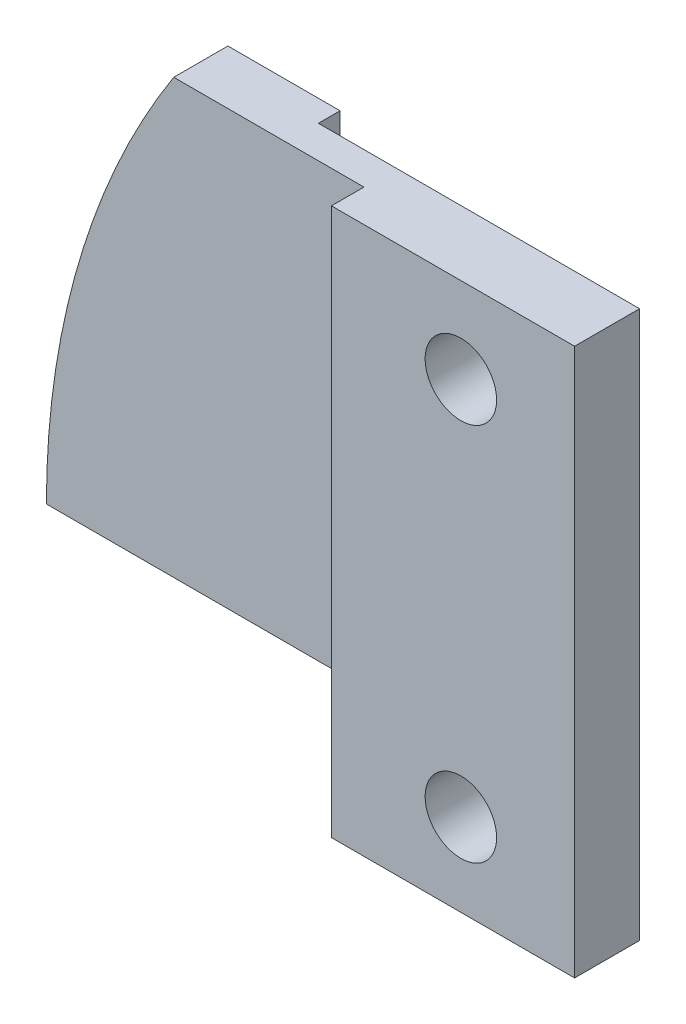
from build123d import *

# Parameters (mm, degrees)
SKETCH1_R           = 1.65
BOSS_EXTRUDE1_DEPTH = 2.5
SKETCH5_R           = 1.65
BOSS_EXTRUDE2_DEPTH = 1.5
CUT_EXTRUDE3_DEPTH  = 1


with BuildPart() as part:
    # Sketch1 → Boss-Extrude1 (new body)
    with BuildSketch(Plane.XY):
        with BuildLine():
            Line((-8.004553297, 23.25769142), (12, 23.25769142))
            Line((12, 23.25769142), (12, 0))
            Line((12, 0), (12, -2))
            Line((12, -2), (0.775731814, -2))
            Line((0.775731814, -2), (0.775731814, 0))
            Line((0.775731814, 0), (0.775731814, 3.25769142))
            Line((0.775731814, 3.25769142), (-13.882660061, 3.25769142))
            ThreePointArc((-13.882660061, 3.25769142), (-12.382699641, 13.680648524), (-8.004553297, 23.25769142))
        make_face()
        with Locations((6.74921921, 19.306101501)):
            Circle(SKETCH1_R, mode=Mode.SUBTRACT)
        with Locations((6.74921921, 1.806101501)):
            Circle(SKETCH1_R, mode=Mode.SUBTRACT)
    extrude(amount=BOSS_EXTRUDE1_DEPTH)

    # Sketch5 → Boss-Extrude2 (add)
    with BuildSketch(Plane.XY.offset(2.5)):
        Polygon((0.775731814, 3.25769142), (0.775731814, 23.25769142), (12, 23.25769142), (12, -2), (0.775731814, -2), align=None)
        with Locations((6.74921921, 19.306101501)):
            Circle(SKETCH5_R, mode=Mode.SUBTRACT)
        with Locations((6.74921921, 1.806101501)):
            Circle(SKETCH5_R, mode=Mode.SUBTRACT)
    extrude(amount=BOSS_EXTRUDE2_DEPTH)

    # Sketch6 → Cut-Extrude3 (cut)
    with BuildSketch(Plane(origin=(0, 0, 0), x_dir=(-1, 0, 0), z_dir=(0, 0, -1))):
        Polygon((-12, 23.25769142), (-12, -2), (-0.775731814, -2), (-0.775731814, 3.25769142), (2.826661011, 3.25769142), (2.826661011, 23.25769142), align=None)
    extrude(amount=-CUT_EXTRUDE3_DEPTH, mode=Mode.SUBTRACT)


solid = part.part
